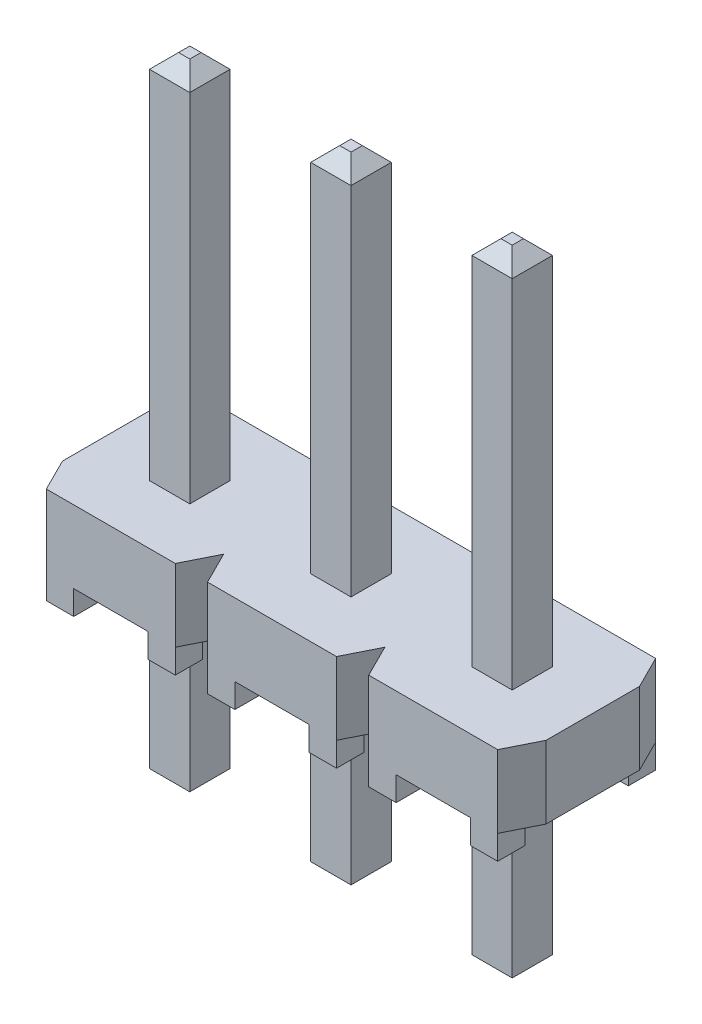
from build123d import *

# Parameters (mm, degrees)
SKETCH1_W                        = 7.62
SKETCH1_H                        = 2.4892
BASE_EXTRUDE_DEPTH               = 0.5715
SNAP_GROOVES_DEPTH               = 5.167922523
SKETCH4_W                        = 0.4318
SKETCH4_H                        = 0.4318
STANDOFFS_DEPTH                  = 0.381
POSITION_PATTERN_COUNT           = 3
POSITION_PATTERN_PITCH           = 2.54
SKETCH5_W                        = 0.635
SKETCH5_H                        = 10
TERMINAL_TH_DEPTH                = 0.3175
T1_TIP1_SIZE                     = 0.2286
TERMINAL_PATTERN_COUNT           = 3
TERMINAL_PATTERN_PITCH           = 2.54
T1_TIP1_OF_TERMINAL_PATTERN_SIZE = 0.2286


with BuildPart() as part:
    # Sketch1 → Base-Extrude (new, symmetric)
    with BuildSketch(Plane(origin=(0, 0, 0), x_dir=(1, 0, 0), z_dir=(0, 1, 0))):
        Rectangle(SKETCH1_W, SKETCH1_H)
    extrude(amount=BASE_EXTRUDE_DEPTH, both=True)

    # Sketch3 → Snap Grooves (cut, through all)
    with BuildSketch(Plane(origin=(0, 0.5715, 0), x_dir=(-1, 0, 0), z_dir=(0, 1, 0))):
        Polygon((1.016, 1.2446), (1.524, 1.2446), (1.27, 0.7366), align=None)
        Polygon((1.016, -1.2446), (1.524, -1.2446), (1.27, -0.7366), align=None)
        Polygon((3.81, -0.7366), (4.064, -1.2446), (3.556, -1.2446), align=None)
        Polygon((3.81, 0.7366), (4.064, 1.2446), (3.556, 1.2446), align=None)
    snap_grooves = extrude(amount=-SNAP_GROOVES_DEPTH, mode=Mode.SUBTRACT)

    # Sketch4 → Standoffs (add)
    with BuildSketch(Plane.XZ.offset(0.5715)):
        with Locations((-3.3401, 1.0287)):
            Rectangle(SKETCH4_W, SKETCH4_H)
        with Locations((-1.7399, 1.0287)):
            Rectangle(SKETCH4_W, SKETCH4_H)
        with Locations((-1.7399, -1.0287)):
            Rectangle(SKETCH4_W, SKETCH4_H)
        with Locations((-3.3401, -1.0287)):
            Rectangle(SKETCH4_W, SKETCH4_H)
    standoffs = extrude(amount=STANDOFFS_DEPTH)

    # Position Pattern: Snap Grooves, Standoffs ×3
    with Locations(*[(i * POSITION_PATTERN_PITCH, 0, 0) for i in range(1, POSITION_PATTERN_COUNT)]):
        add(snap_grooves, mode=Mode.SUBTRACT)
        add(standoffs)

    # Sketch5 → Terminal -TH (add, symmetric)
    with BuildSketch(Plane.ZY.offset(2.54)):
        with Locations((0, 1.4135)):
            Rectangle(SKETCH5_W, SKETCH5_H)
    terminal_th = extrude(amount=TERMINAL_TH_DEPTH, both=True)

    # T1 Tip1
    t1_tip1_edges = [part.edges().sort_by_distance(p)[0] for p in [
        (-2.54, -3.5865, 0.3175),
        (-2.8575, -3.5865, 0),
        (-2.54, 6.4135, -0.3175),
        (-2.2225, -3.5865, 0),
        (-2.54, -3.5865, -0.3175),
        (-2.2225, 6.4135, 0),
        (-2.54, 6.4135, 0.3175),
        (-2.8575, 6.4135, 0),
    ]]
    chamfer(t1_tip1_edges, length=T1_TIP1_SIZE)

    # Terminal Pattern: Terminal -TH ×3
    with Locations(*[(i * TERMINAL_PATTERN_PITCH, 0, 0) for i in range(1, TERMINAL_PATTERN_COUNT)]):
        add(terminal_th)

    # T1 Tip1 of Terminal Pattern
    t1_tip1_of_terminal_pattern_edges = [part.edges().sort_by_distance(p)[0] for p in [
        (0, -3.5865, 0.3175),
        (-0.3175, -3.5865, 0),
        (0, 6.4135, -0.3175),
        (0.3175, -3.5865, 0),
        (0, -3.5865, -0.3175),
        (0.3175, 6.4135, 0),
        (0, 6.4135, 0.3175),
        (-0.3175, 6.4135, 0),
        (2.54, -3.5865, 0.3175),
        (2.2225, -3.5865, 0),
        (2.54, 6.4135, -0.3175),
        (2.8575, -3.5865, 0),
        (2.54, -3.5865, -0.3175),
        (2.8575, 6.4135, 0),
        (2.54, 6.4135, 0.3175),
        (2.2225, 6.4135, 0),
    ]]
    chamfer(t1_tip1_of_terminal_pattern_edges, length=T1_TIP1_OF_TERMINAL_PATTERN_SIZE)


solid = part.part
